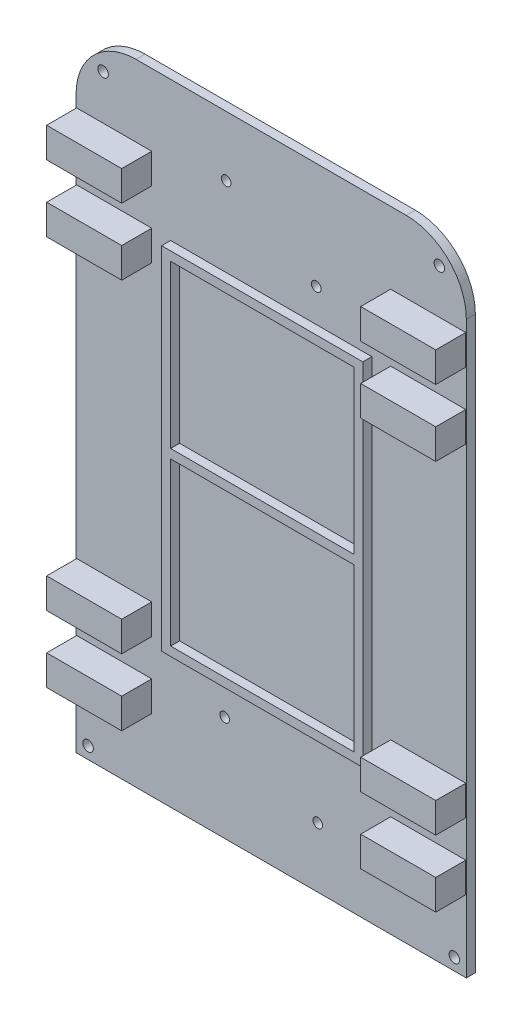
from build123d import *

# Parameters (mm, degrees)
SKETCH1_W               = 130
SKETCH1_H               = 210
BOSS_EXTRUDE1_DEPTH     = 3
FILLET1_R               = 20
FILLET2_R               = 20
SKETCH2_W               = 25
SKETCH2_H               = 10
BOSS_EXTRUDE2_DEPTH     = 10
MIRROR2_COPY_1_SKETCH_W = 25
MIRROR2_COPY_1_SKETCH_H = 10
MIRROR2_COPY_1_DEPTH    = 10
SKETCH3_W               = 67
SKETCH3_H               = 60
SKETCH3_W_2             = 61
SKETCH3_H_2             = 54
BOSS_EXTRUDE3_DEPTH     = 3
CROQUIS1_R              = 1.6
CORTAR_EXTRUIR1_DEPTH   = 10
CROQUIS2_R              = 1.75
CORTAR_EXTRUIR2_DEPTH   = 10


with BuildPart() as part:
    # Sketch1 → Boss-Extrude1 (new body)
    with BuildSketch(Plane.XY):
        Rectangle(SKETCH1_W, SKETCH1_H)
    extrude(amount=BOSS_EXTRUDE1_DEPTH)

    # Fillet1
    fillet1_edges = [part.edges().sort_by_distance(p)[0] for p in [
        (-65, 105, 1.5),
    ]]
    fillet(fillet1_edges, radius=FILLET1_R)

    # Fillet2
    fillet2_edges = [part.edges().sort_by_distance(p)[0] for p in [
        (65, 105, 1.5),
    ]]
    fillet(fillet2_edges, radius=FILLET2_R)

    # Sketch2 → Boss-Extrude2 (add)
    with BuildSketch(Plane.XY.offset(3)):
        with Locations((52.3, 53.9)):
            Rectangle(SKETCH2_W, SKETCH2_H)
        with Locations((52.3, 76.1)):
            Rectangle(SKETCH2_W, SKETCH2_H)
    boss_extrude2 = extrude(amount=BOSS_EXTRUDE2_DEPTH)

    # Mirror1: Boss-Extrude2 across plane
    add(boss_extrude2.mirror(Plane.ZX))

    # Mirror2: Boss-Extrude2 across plane
    add(boss_extrude2.mirror(Plane(origin=(0, 0, 0), x_dir=(0, 0, 1), z_dir=(1, 0, 0))))

    # Mirror2 copy 1 sketch → Mirror2 copy 1 (add)
    with BuildSketch(Plane(origin=(0, 0, 3), x_dir=(-1, 0, 0), z_dir=(0, 0, 1))):
        with Locations((52.3, 53.9)):
            Rectangle(MIRROR2_COPY_1_SKETCH_W, MIRROR2_COPY_1_SKETCH_H)
        with Locations((52.3, 76.1)):
            Rectangle(MIRROR2_COPY_1_SKETCH_W, MIRROR2_COPY_1_SKETCH_H)
    extrude(amount=MIRROR2_COPY_1_DEPTH)

    # Sketch3 → Boss-Extrude3 (add)
    with BuildSketch(Plane.XY.offset(3)):
        with Locations((0, 28.5)):
            Rectangle(SKETCH3_W, SKETCH3_H)
        with Locations((0, 28.5)):
            Rectangle(SKETCH3_W_2, SKETCH3_H_2, mode=Mode.SUBTRACT)
    boss_extrude3 = extrude(amount=BOSS_EXTRUDE3_DEPTH)

    # Mirror3: Boss-Extrude3 across plane
    add(boss_extrude3.mirror(Plane.ZX))

    # Croquis1 → Cortar-Extruir1 (cut)
    with BuildSketch(Plane.XY.offset(3)):
        with Locations((-15, 85)):
            Circle(CROQUIS1_R)
        with Locations((15, 69.5)):
            Circle(CROQUIS1_R)
        with Locations((-15.5, -70)):
            Circle(CROQUIS1_R)
        with Locations((15.5, -85)):
            Circle(CROQUIS1_R)
    extrude(amount=-CORTAR_EXTRUIR1_DEPTH, mode=Mode.SUBTRACT)

    # Croquis2 → Cortar-Extruir2 (cut)
    with BuildSketch(Plane.XY.offset(3)):
        with Locations((-61, -101)):
            Circle(CROQUIS2_R)
        with Locations((61, -101)):
            Circle(CROQUIS2_R)
        with Locations((56, 96)):
            Circle(CROQUIS2_R)
        with Locations((-56, 96)):
            Circle(CROQUIS2_R)
    extrude(amount=-CORTAR_EXTRUIR2_DEPTH, mode=Mode.SUBTRACT)


solid = part.part
